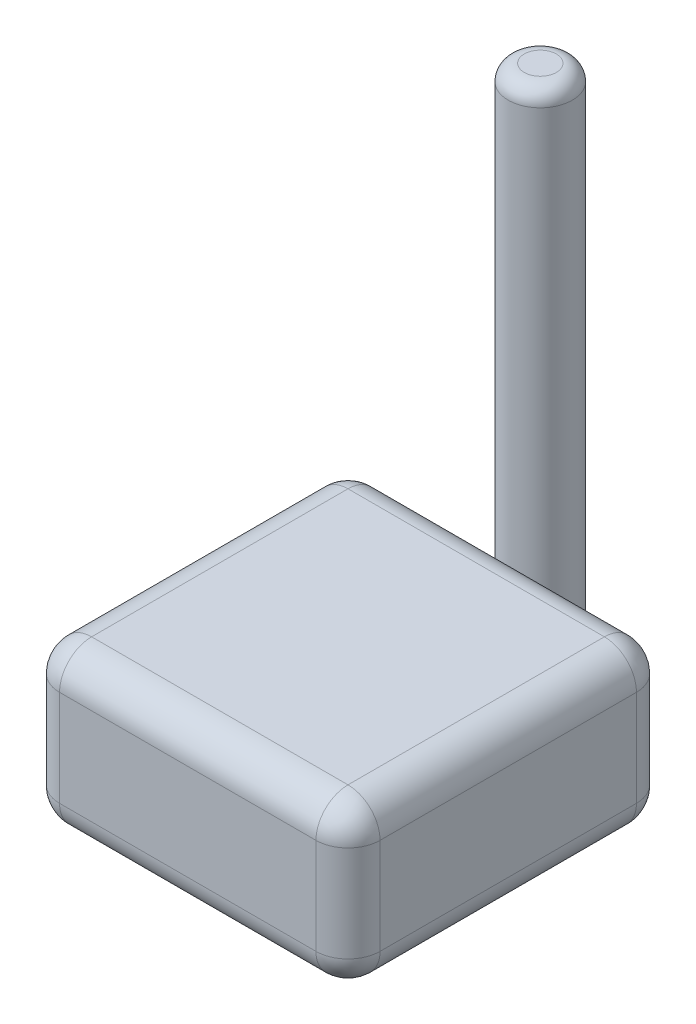
from build123d import *

# Parameters (mm, degrees)
SKETCH2_W           = 20
SKETCH2_H           = 10
BOSS_EXTRUDE1_DEPTH = 10
FILLET1_R           = 2
BOSS_EXTRUDE2_START = 10
SKETCH4_R           = 2
BOSS_EXTRUDE2_DEPTH = 15
FILLET2_R           = 1


with BuildPart() as part:
    # Sketch2 → Boss-Extrude1 (new, symmetric)
    with BuildSketch(Plane.XY):
        with Locations((-51.426434777, 15.404281135)):
            Rectangle(SKETCH2_W, SKETCH2_H)
    extrude(amount=BOSS_EXTRUDE1_DEPTH, both=True)

    # Fillet1
    fillet1_edges = [part.edges().sort_by_distance(p)[0] for p in [
        (-61.426434777, 15.404281135, 10),
        (-51.426434777, 10.404281135, 10),
        (-41.426434777, 15.404281135, 10),
        (-51.426434777, 10.404281135, -10),
        (-61.426434777, 15.404281135, -10),
        (-51.426434777, 20.404281135, -10),
        (-41.426434777, 15.404281135, -10),
        (-41.426434777, 10.404281135, 0),
        (-61.426434777, 10.404281135, 0),
        (-61.426434777, 20.404281135, 0),
        (-41.426434777, 20.404281135, 0),
        (-51.426434777, 20.404281135, 10),
    ]]
    fillet(fillet1_edges, radius=FILLET1_R)


with BuildPart() as body_2:
    # Sketch4 → Boss-Extrude2 (new, symmetric)
    with BuildSketch(Plane(origin=(0, 20.404281135, 0), x_dir=(1, 0, 0), z_dir=(0, 1, 0)).offset(BOSS_EXTRUDE2_START)):
        with Locations(Location((-51.426434777, 12, 0), (0, 0, 180))):
            Circle(SKETCH4_R)
    extrude(amount=BOSS_EXTRUDE2_DEPTH, both=True)

    # Fillet2
    fillet2_edges = [body_2.edges().sort_by_distance(p)[0] for p in [
        (-49.426434777, 45.404281135, -12),
    ]]
    fillet(fillet2_edges, radius=FILLET2_R)


solid = Compound([part.part, body_2.part])
